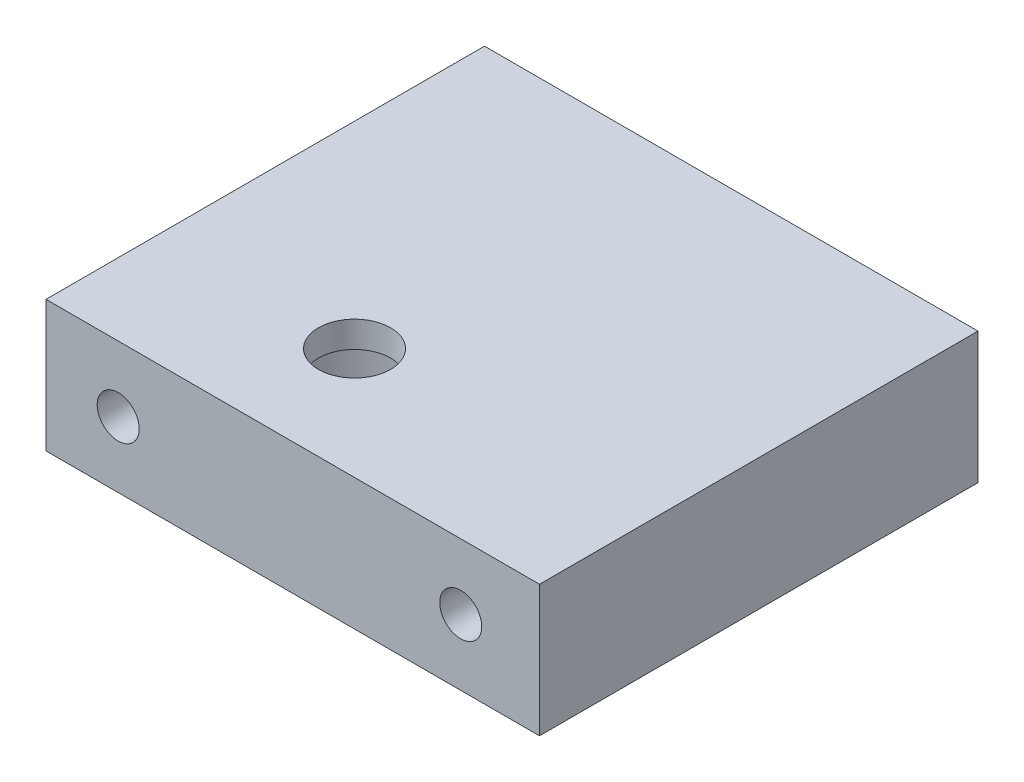
from build123d import *

# Parameters (mm, degrees)
SKETCH1_W           = 37.589281877
SKETCH1_H           = 10
BOSS_EXTRUDE1_DEPTH = 33.4
SKETCH2_R           = 6.5
CUT_EXTRUDE1_DEPTH  = 10
SKETCH3_R           = 1.6
CUT_EXTRUDE2_DEPTH  = 50
SKETCH4_R           = 6.6
SKETCH4_R_2         = 2.75
BOSS_EXTRUDE2_DEPTH = 2


with BuildPart() as part:
    # Sketch1 → Boss-Extrude1 (new body)
    with BuildSketch(Plane.XY):
        with Locations((10.006008035, 10.584218221)):
            Rectangle(SKETCH1_W, SKETCH1_H)
    extrude(amount=BOSS_EXTRUDE1_DEPTH)

    # Sketch2 → Cut-Extrude1 (cut)
    with BuildSketch(Plane(origin=(0, 15.584218221, 0), x_dir=(1, 0, 0), z_dir=(0, 1, 0))):
        with Locations(Location((6.211367096, -24.9, 0), (0, 0, 270))):
            Circle(SKETCH2_R)
    extrude(amount=-CUT_EXTRUDE1_DEPTH, mode=Mode.SUBTRACT)

    # Sketch3 → Cut-Extrude2 (cut)
    with BuildSketch(Plane.XY.offset(33.4)):
        with Locations((-3.288632904, 10.584218221)):
            Circle(SKETCH3_R)
        with Locations((22.800648973, 10.584218221)):
            Circle(SKETCH3_R)
    extrude(amount=-CUT_EXTRUDE2_DEPTH, mode=Mode.SUBTRACT)

    # Sketch4 → Boss-Extrude2 (add)
    with BuildSketch(Plane.XZ.offset(-5.584218221)):
        with Locations((6.211367096, 24.9)):
            Circle(SKETCH4_R)
        with Locations(Location((6.211367096, 24.9, 0), (0, 0, 270))):
            Circle(SKETCH4_R_2, mode=Mode.SUBTRACT)
    extrude(amount=-BOSS_EXTRUDE2_DEPTH)


with BuildPart() as body_2:
    # Mirror1: mirrored copy
    add(part.part.mirror(Plane(origin=(-8.788632904, 15.584218221, 33.4), x_dir=(0, 0, 1), z_dir=(0, 1, 0))))


solid = body_2.part
